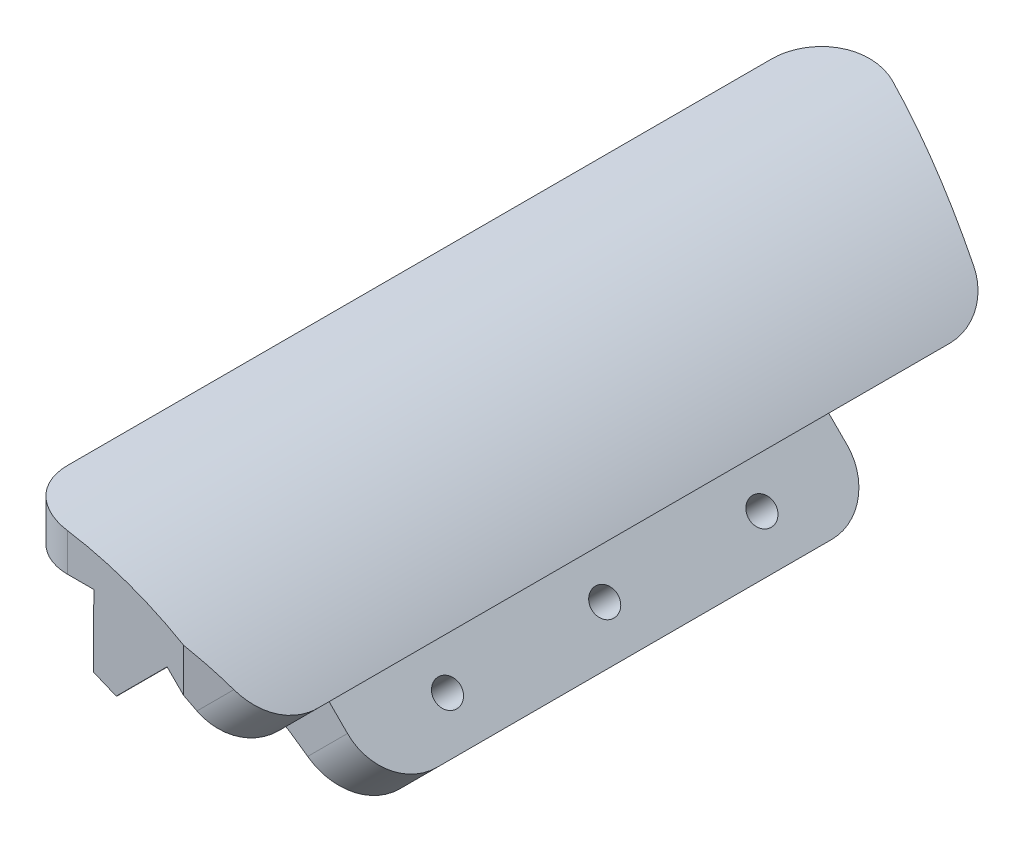
from build123d import *

# Parameters (mm, degrees)
BOSS_EXTRUDE1_DEPTH                 = 170
CUT_EXTRUDE2_DEPTH                  = 1378.200029658
CUT_EXTRUDE2_DEPTH_BACK             = 1378.200029658
SKETCH7_W                           = 60.055026026
SKETCH7_H                           = 40
SKETCH7_H_2                         = 30
CUT_EXTRUDE7_DEPTH                  = 20.697901
FILLET1_R                           = 10
CUT_EXTRUDE3_REACH                  = 1001.772
CUT_EXTRUDE3_END_RADIUS             = 68.41639524
SKETCH3_R                           = 2.5
CUT_EXTRUDE3_DIRECTION_2_DEPTH      = 10
SKETCH4_R                           = 2.5
CUT_EXTRUDE4_DEPTH                  = 10
CUT_EXTRUDE4_DIRECTION_2_REACH      = 1377.394
CUT_EXTRUDE4_DIRECTION_2_END_RADIUS = 68.41639524
CUT_EXTRUDE5_REACH                  = 1377.394
SKETCH5_R                           = 5
CUT_EXTRUDE6_REACH                  = 1001.772
SKETCH6_R                           = 5


with BuildPart() as part:
    # Sketch1 → Boss-Extrude1 (new body)
    with BuildSketch(Plane.XY):
        with BuildLine():
            Line((1349.709167159, 7.051545827), (1340.728911037, -1.928710294))
            Line((1340.728911037, -1.928710294), (1340.375357647, -2.282263684))
            Line((1340.375357647, -2.282263684), (1361.562180969, -23.469087006))
            Line((1361.562180969, -23.469087006), (1354.491113157, -30.540154818))
            ThreePointArc((1354.491113157, -30.540154818), (1332.276376869, -15.701535719), (1306.072590331, -10.501468778))
            Line((1306.072590331, -10.501468778), (1306.072590331, -0.501468778))
            Line((1306.072590331, -0.501468778), (1336.035283217, -0.501468778))
            Line((1336.035283217, -0.501468778), (1336.035283217, -0.001468778))
            Line((1336.035283217, -0.001468778), (1336.072590331, 12.698531222))
            Line((1336.072590331, 12.698531222), (1336.072590331, 13.198531222))
            Line((1336.072590331, 13.198531222), (1321.072590331, 13.198531222))
            Line((1321.072590331, 13.198531222), (1321.072590331, 21.198531222))
            ThreePointArc((1321.072590331, 21.198531222), (1345.563373492, 16.327364444), (1366.326176516, 2.45535175))
            Line((1366.326176516, 2.45535175), (1360.669322267, -3.2015025))
            Line((1360.669322267, -3.2015025), (1350.062720549, 7.405099218))
            Line((1350.062720549, 7.405099218), (1349.709167159, 7.051545827))
        make_face()
    extrude(amount=-BOSS_EXTRUDE1_DEPTH)

    # Sketch2 → Cut-Extrude2 (cut, two sides: drawn at the far end of the back side and taken through both)
    with BuildSketch(Plane(origin=(0, 0, 0), x_dir=(1, 0, 0), z_dir=(0, 1, 0)).offset(-CUT_EXTRUDE2_DEPTH_BACK)):
        Polygon((1306.072590331, 165.353911181), (1366.326176516, 140.977580956), (1366.326176516, 170), (1306.072590331, 170), align=None)
        Polygon((1366.326176516, 4.246407684), (1353.192629401, 0), (1366.326176516, 0), align=None)
    extrude(amount=CUT_EXTRUDE2_DEPTH + CUT_EXTRUDE2_DEPTH_BACK, mode=Mode.SUBTRACT)

    # Sketch7 → Cut-Extrude7 (cut)
    with BuildSketch(Plane(origin=(187.283823237, 452.52498352, 0), x_dir=(-0.923993669874315, 0.38240776408461624, 0), z_dir=(-0.3824077640846163, -0.9239936698743151, 0))):
        with Locations((-1237.02208443, 145.353911181)):
            Rectangle(SKETCH7_W, SKETCH7_H)
        with Locations((-1237.02208443, 15)):
            Rectangle(SKETCH7_W, SKETCH7_H_2)
    extrude(amount=-CUT_EXTRUDE7_DEPTH, mode=Mode.SUBTRACT)

    # Fillet1
    fillet1_edges = [part.edges().sort_by_distance(p)[0] for p in [
        (1363.497749392, -0.373075375, -3.331905717),
        (1321.072590331, 17.198531222, 0),
        (1363.497749392, -0.373075375, -142.121855977),
        (1321.072590331, 17.198531222, -159.285476478),
        (1306.072590331, -5.501468778, -30),
        (1306.072590331, -5.501468778, -125.353911181),
        (1358.026647063, -27.004620912, -125.353911181),
        (1358.026647063, -27.004620912, -30),
    ]]
    fillet(fillet1_edges, radius=FILLET1_R)

    # Cut-Extrude3: up to this cylinder (the profile starts outside it)
    cut_extrude3_end = Plane(origin=(1306.113416139, -78.917851837, -77.676956), z_dir=(0, 0, 1)) * Cylinder(CUT_EXTRUDE3_END_RADIUS, 2201.37679048, mode=Mode.PRIVATE)
    # Sketch3 → Cut-Extrude3 (cut, up to the surface)
    with BuildSketch(Plane(origin=(661.975479169, 661.975479169, 0), x_dir=(0, 0, 1), z_dir=(0.7071067811866074, 0.7071067811864877, 0)), mode=Mode.PRIVATE) as cut_extrude3_sk1:
        with Locations(Location((-77.676955591, 971.365001741, 0), (0, 0, 270))):
            Circle(SKETCH3_R)
    cut_extrude3_tool1 = extrude(cut_extrude3_sk1.sketch, amount=-CUT_EXTRUDE3_REACH, mode=Mode.PRIVATE) - cut_extrude3_end
    add(cut_extrude3_tool1.solids().sort_by_distance((1348.834259, -24.883301, -77.676956))[0], mode=Mode.SUBTRACT)
    # Sketch3 → Cut-Extrude3 (cut, up to the surface)
    with BuildSketch(Plane(origin=(661.975479169, 661.975479169, 0), x_dir=(0, 0, 1), z_dir=(0.7071067811866074, 0.7071067811864877, 0)), mode=Mode.PRIVATE) as cut_extrude3_sk2:
        with Locations(Location((-107.676955591, 971.365001741, 0), (0, 0, 270))):
            Circle(SKETCH3_R)
    cut_extrude3_tool2 = extrude(cut_extrude3_sk2.sketch, amount=-CUT_EXTRUDE3_REACH, mode=Mode.PRIVATE) - cut_extrude3_end
    add(cut_extrude3_tool2.solids().sort_by_distance((1348.834259, -24.883301, -107.676956))[0], mode=Mode.SUBTRACT)
    # Sketch3 → Cut-Extrude3 (cut, up to the surface)
    with BuildSketch(Plane(origin=(661.975479169, 661.975479169, 0), x_dir=(0, 0, 1), z_dir=(0.7071067811866074, 0.7071067811864877, 0)), mode=Mode.PRIVATE) as cut_extrude3_sk3:
        with Locations(Location((-47.676955591, 971.365001741, 0), (0, 0, 270))):
            Circle(SKETCH3_R)
    cut_extrude3_tool3 = extrude(cut_extrude3_sk3.sketch, amount=-CUT_EXTRUDE3_REACH, mode=Mode.PRIVATE) - cut_extrude3_end
    add(cut_extrude3_tool3.solids().sort_by_distance((1348.834259, -24.883301, -47.676956))[0], mode=Mode.SUBTRACT)

    # Sketch3 → Cut-Extrude3 direction 2 (cut)
    with BuildSketch(Plane(origin=(661.975479169, 661.975479169, 0), x_dir=(0, 0, 1), z_dir=(0.7071067811866074, 0.7071067811864877, 0))):
        with Locations(Location((-77.676955591, 971.365001741, 0), (0, 0, 270))):
            Circle(SKETCH3_R)
        with Locations(Location((-107.676955591, 971.365001741, 0), (0, 0, 270))):
            Circle(SKETCH3_R)
        with Locations(Location((-47.676955591, 971.365001741, 0), (0, 0, 270))):
            Circle(SKETCH3_R)
    extrude(amount=CUT_EXTRUDE3_DIRECTION_2_DEPTH, mode=Mode.SUBTRACT)

    # Sketch4 → Cut-Extrude4 (cut)
    with BuildSketch(Plane(origin=(0, -10.501468778, 0), x_dir=(0, 0, 1), z_dir=(0, -1, 0))):
        with Locations((-107.676955591, -1314.072590331)):
            Circle(SKETCH4_R)
        with Locations((-77.676955591, -1314.072590331)):
            Circle(SKETCH4_R)
        with Locations((-47.676955591, -1314.072590331)):
            Circle(SKETCH4_R)
    extrude(amount=-CUT_EXTRUDE4_DEPTH, mode=Mode.SUBTRACT)

    # Cut-Extrude4 direction 2: up to this cylinder (the profile starts outside it)
    cut_extrude4_direction_2_end = Plane(origin=(1306.113416139, -78.917851837, -77.676956), z_dir=(0, 0, 1)) * Cylinder(CUT_EXTRUDE4_DIRECTION_2_END_RADIUS, 2952.62079048, mode=Mode.PRIVATE)
    # Sketch4 → Cut-Extrude4 direction 2 (cut, up to the surface)
    with BuildSketch(Plane(origin=(0, -10.501468778, 0), x_dir=(0, 0, 1), z_dir=(0, -1, 0)), mode=Mode.PRIVATE) as cut_extrude4_direction_2_sk1:
        with Locations((-107.676955591, -1314.072590331)):
            Circle(SKETCH4_R)
    cut_extrude4_direction_2_tool1 = extrude(cut_extrude4_direction_2_sk1.sketch, amount=CUT_EXTRUDE4_DIRECTION_2_REACH, mode=Mode.PRIVATE) - cut_extrude4_direction_2_end
    add(cut_extrude4_direction_2_tool1.solids().sort_by_distance((1314.07259, -10.501469, -107.676956))[0], mode=Mode.SUBTRACT)
    # Sketch4 → Cut-Extrude4 direction 2 (cut, up to the surface)
    with BuildSketch(Plane(origin=(0, -10.501468778, 0), x_dir=(0, 0, 1), z_dir=(0, -1, 0)), mode=Mode.PRIVATE) as cut_extrude4_direction_2_sk2:
        with Locations((-77.676955591, -1314.072590331)):
            Circle(SKETCH4_R)
    cut_extrude4_direction_2_tool2 = extrude(cut_extrude4_direction_2_sk2.sketch, amount=CUT_EXTRUDE4_DIRECTION_2_REACH, mode=Mode.PRIVATE) - cut_extrude4_direction_2_end
    add(cut_extrude4_direction_2_tool2.solids().sort_by_distance((1314.07259, -10.501469, -77.676956))[0], mode=Mode.SUBTRACT)
    # Sketch4 → Cut-Extrude4 direction 2 (cut, up to the surface)
    with BuildSketch(Plane(origin=(0, -10.501468778, 0), x_dir=(0, 0, 1), z_dir=(0, -1, 0)), mode=Mode.PRIVATE) as cut_extrude4_direction_2_sk3:
        with Locations((-47.676955591, -1314.072590331)):
            Circle(SKETCH4_R)
    cut_extrude4_direction_2_tool3 = extrude(cut_extrude4_direction_2_sk3.sketch, amount=CUT_EXTRUDE4_DIRECTION_2_REACH, mode=Mode.PRIVATE) - cut_extrude4_direction_2_end
    add(cut_extrude4_direction_2_tool3.solids().sort_by_distance((1314.07259, -10.501469, -47.676956))[0], mode=Mode.SUBTRACT)

    # Sketch5 → Cut-Extrude5 (cut, up to next)
    with BuildSketch(Plane(origin=(0, -10.501468778, 0), x_dir=(0, 0, 1), z_dir=(0, -1, 0)), mode=Mode.PRIVATE) as cut_extrude5_sk1:
        with Locations((-47.676955591, -1314.072590331)):
            Circle(SKETCH5_R)
    cut_extrude5_tool1 = extrude(cut_extrude5_sk1.sketch, amount=CUT_EXTRUDE5_REACH, mode=Mode.PRIVATE) & part.part
    # Sketch5 → Cut-Extrude5 (cut, up to next)
    with BuildSketch(Plane(origin=(0, -10.501468778, 0), x_dir=(0, 0, 1), z_dir=(0, -1, 0)), mode=Mode.PRIVATE) as cut_extrude5_sk2:
        with Locations((-77.676955591, -1314.072590331)):
            Circle(SKETCH5_R)
    cut_extrude5_tool2 = extrude(cut_extrude5_sk2.sketch, amount=CUT_EXTRUDE5_REACH, mode=Mode.PRIVATE) & part.part
    # Sketch5 → Cut-Extrude5 (cut, up to next)
    with BuildSketch(Plane(origin=(0, -10.501468778, 0), x_dir=(0, 0, 1), z_dir=(0, -1, 0)), mode=Mode.PRIVATE) as cut_extrude5_sk3:
        with Locations((-107.676955591, -1314.072590331)):
            Circle(SKETCH5_R)
    cut_extrude5_tool3 = extrude(cut_extrude5_sk3.sketch, amount=CUT_EXTRUDE5_REACH, mode=Mode.PRIVATE) & part.part
    add(cut_extrude5_tool1.solids().sort_by_distance((1314.07259, -10.501469, -47.676956))[0], mode=Mode.SUBTRACT)
    add(cut_extrude5_tool2.solids().sort_by_distance((1314.07259, -10.501469, -77.676956))[0], mode=Mode.SUBTRACT)
    add(cut_extrude5_tool3.solids().sort_by_distance((1314.07259, -10.501469, -107.676956))[0], mode=Mode.SUBTRACT)

    # Sketch6 → Cut-Extrude6 (cut, up to next)
    with BuildSketch(Plane(origin=(661.975479169, 661.975479169, 0), x_dir=(0, 0, 1), z_dir=(0.7071067811866074, 0.7071067811864877, 0)), mode=Mode.PRIVATE) as cut_extrude6_sk1:
        with Locations(Location((-107.676955591, 971.365001741, 0), (0, 0, 270))):
            Circle(SKETCH6_R)
    cut_extrude6_tool1 = extrude(cut_extrude6_sk1.sketch, amount=-CUT_EXTRUDE6_REACH, mode=Mode.PRIVATE) & part.part
    # Sketch6 → Cut-Extrude6 (cut, up to next)
    with BuildSketch(Plane(origin=(661.975479169, 661.975479169, 0), x_dir=(0, 0, 1), z_dir=(0.7071067811866074, 0.7071067811864877, 0)), mode=Mode.PRIVATE) as cut_extrude6_sk2:
        with Locations(Location((-77.676955591, 971.365001741, 0), (0, 0, 270))):
            Circle(SKETCH6_R)
    cut_extrude6_tool2 = extrude(cut_extrude6_sk2.sketch, amount=-CUT_EXTRUDE6_REACH, mode=Mode.PRIVATE) & part.part
    # Sketch6 → Cut-Extrude6 (cut, up to next)
    with BuildSketch(Plane(origin=(661.975479169, 661.975479169, 0), x_dir=(0, 0, 1), z_dir=(0.7071067811866074, 0.7071067811864877, 0)), mode=Mode.PRIVATE) as cut_extrude6_sk3:
        with Locations(Location((-47.676955591, 971.365001741, 0), (0, 0, 270))):
            Circle(SKETCH6_R)
    cut_extrude6_tool3 = extrude(cut_extrude6_sk3.sketch, amount=-CUT_EXTRUDE6_REACH, mode=Mode.PRIVATE) & part.part
    add(cut_extrude6_tool1.solids().sort_by_distance((1348.834259, -24.883301, -107.676956))[0], mode=Mode.SUBTRACT)
    add(cut_extrude6_tool2.solids().sort_by_distance((1348.834259, -24.883301, -77.676956))[0], mode=Mode.SUBTRACT)
    add(cut_extrude6_tool3.solids().sort_by_distance((1348.834259, -24.883301, -47.676956))[0], mode=Mode.SUBTRACT)


solid = part.part
